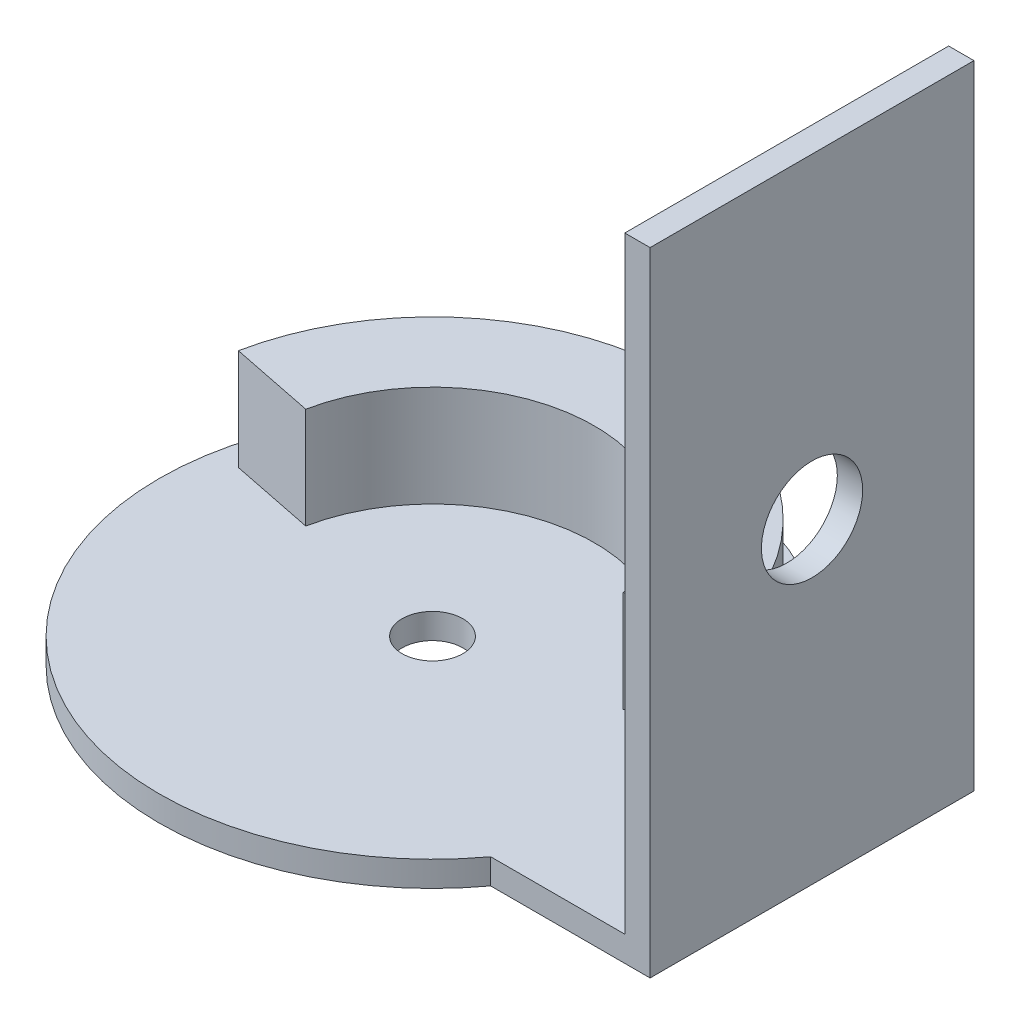
from build123d import *

# Parameters (mm, degrees)
BOSS_EXTRUDE1_DEPTH = 10
SKETCH2_R           = 3
BOSS_EXTRUDE2_DEPTH = 2.5
SKETCH4_W           = 2.5
SKETCH4_H           = 32
BOSS_EXTRUDE3_DEPTH = 60
SKETCH5_R           = 5
CUT_EXTRUDE1_DEPTH  = 10


with BuildPart() as part:
    # Sketch1 → Boss-Extrude1 (new body)
    with BuildSketch(Plane(origin=(0, 0, 0), x_dir=(1, 0, 0), z_dir=(0, 1, 0))):
        with BuildLine():
            Line((-24.017268371, 4.839506173), (-15.684746691, 3.160493827))
            ThreePointArc((-15.684746691, 3.160493827), (0, 16), (15.684746691, 3.160493827))
            Line((15.684746691, 3.160493827), (24.017268371, 4.839506173))
            ThreePointArc((24.017268371, 4.839506173), (0, 24.5), (-24.017268371, 4.839506173))
        make_face()
    extrude(amount=BOSS_EXTRUDE1_DEPTH)

    # Sketch2 → Boss-Extrude2 (add)
    with BuildSketch(Plane.XZ):
        with BuildLine():
            Line((37.5, -16), (37.5, 16))
            Line((37.5, 16), (21.748563171, 16))
            ThreePointArc((21.748563171, 16), (12.186057607, 24.093567606), (0, 27))
            ThreePointArc((0, 27), (-27, 0), (0, -27))
            ThreePointArc((0, -27), (12.186057607, -24.093567606), (21.748563171, -16))
            Line((21.748563171, -16), (37.5, -16))
        make_face()
        Circle(SKETCH2_R, mode=Mode.SUBTRACT)
    extrude(amount=BOSS_EXTRUDE2_DEPTH)

    # Sketch4 → Boss-Extrude3 (add)
    with BuildSketch(Plane(origin=(0, 0, 0), x_dir=(1, 0, 0), z_dir=(0, 1, 0))):
        with Locations((36.25, 0)):
            Rectangle(SKETCH4_W, SKETCH4_H)
    extrude(amount=BOSS_EXTRUDE3_DEPTH)

    # Sketch5 → Cut-Extrude1 (cut)
    with BuildSketch(Plane(origin=(37.5, 0, 0), x_dir=(0, 0, -1), z_dir=(1, 0, 0))):
        with Locations((0, 28.75)):
            Circle(SKETCH5_R)
    extrude(amount=-CUT_EXTRUDE1_DEPTH, mode=Mode.SUBTRACT)


solid = part.part
